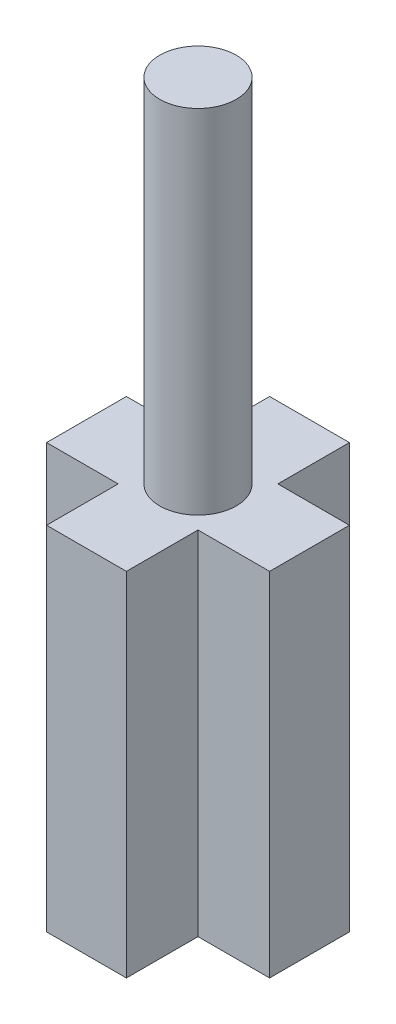
from build123d import *

# Parameters (mm, degrees)
BOSS_EXTRUDE1_DEPTH = 7.62
SKETCH2_R           = 0.82804
BOSS_EXTRUDE2_DEPTH = 7.62


with BuildPart() as part:
    # Sketch1 → Boss-Extrude1 (new body)
    with BuildSketch(Plane(origin=(0, 0, 0), x_dir=(1, 0, 0), z_dir=(0, 1, 0))):
        Polygon((0.8636, 0.8636), (2.413, 0.8636), (2.413, -0.8636), (0.8636, -0.8636), (0.8636, -2.413), (-0.8636, -2.413), (-0.8636, -0.8636), (-2.413, -0.8636), (-2.413, 0.8636), (-0.8636, 0.8636), (-0.8636, 2.413), (0.8636, 2.413), align=None)
    extrude(amount=BOSS_EXTRUDE1_DEPTH)

    # Sketch2 → Boss-Extrude2 (add)
    with BuildSketch(Plane(origin=(0, 7.62, 0), x_dir=(1, 0, 0), z_dir=(0, 1, 0))):
        with Locations(Location((0, 0, 0), (0, 0, 270))):
            Circle(SKETCH2_R)
    extrude(amount=BOSS_EXTRUDE2_DEPTH)


solid = part.part
